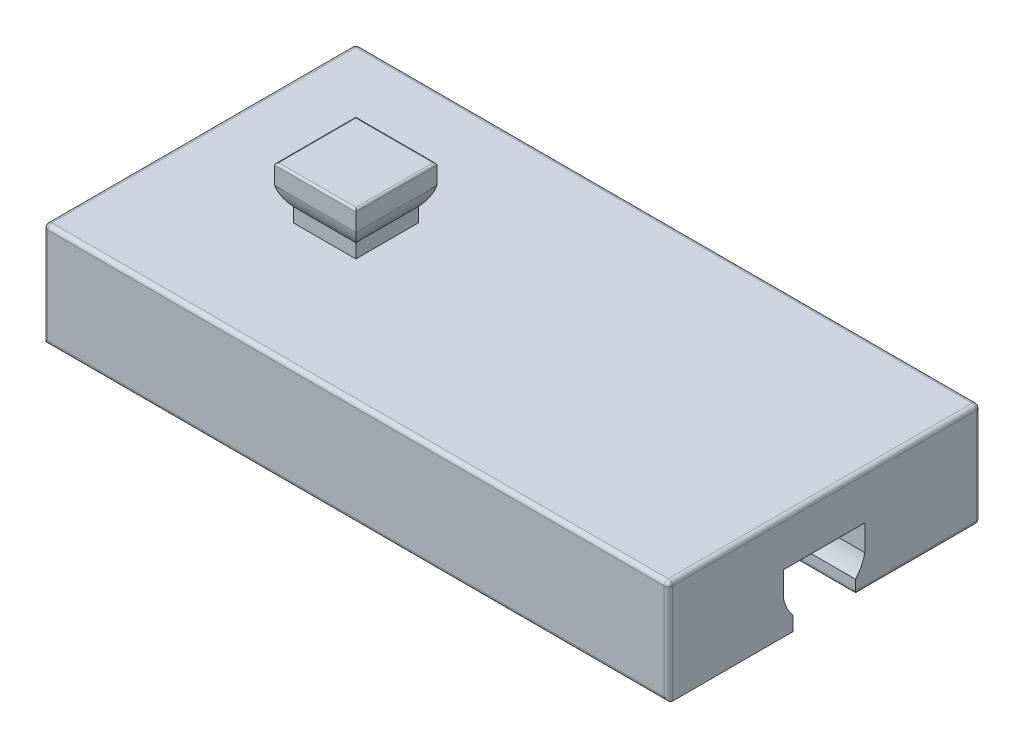
from build123d import *

# Parameters (mm, degrees)
SKETCH_1_W           = 30
SKETCH_1_H           = 15
EXTRUDE_1_DEPTH      = 5
CUT_EXTRUDE_1_REACH  = 33.325
FILLET_1_R           = 0.2
SKETCH_3_W           = 3
SKETCH_3_H           = 3
EXTRUDE_2_DEPTH      = 1
EXTRUDE_3_DEPTH      = 2
EXTRUDE_3_DEPTH_BACK = 2
CUT_EXTRUDE_2_REACH  = 28.652
FILLET_2_R           = 0.1


with BuildPart() as part:
    # 草图1 → 凸台-拉伸1 (new body)
    with BuildSketch(Plane(origin=(0, 0, 0), x_dir=(1, 0, 0), z_dir=(0, 1, 0))):
        Rectangle(SKETCH_1_W, SKETCH_1_H)
    extrude(amount=EXTRUDE_1_DEPTH)

    # 草图2 → 切除-拉伸1 (cut, up to next)
    with BuildSketch(Plane.ZY.offset(15), mode=Mode.PRIVATE) as cut_extrude_1_sk1:
        with BuildLine():
            Line((-1.5, 0), (-1.5, 0.677124344))
            ThreePointArc((-1.5, 0.677124344), (-1.780042303, 1.088161527), (-1.95, 1.555590279))
            Line((-1.95, 1.555590279), (-1.95, 2.8))
            Line((-1.95, 2.8), (1.95, 2.8))
            Line((1.95, 2.8), (1.95, 1.555590279))
            ThreePointArc((1.95, 1.555590279), (1.780042303, 1.088161527), (1.5, 0.677124344))
            Line((1.5, 0.677124344), (1.5, 0))
            Line((1.5, 0), (-1.5, 0))
        make_face()
    cut_extrude_1_tool1 = extrude(cut_extrude_1_sk1.sketch, amount=-CUT_EXTRUDE_1_REACH, mode=Mode.PRIVATE) & part.part
    add(cut_extrude_1_tool1.solids().sort_by_distance((-15, 1.479302, 0))[0], mode=Mode.SUBTRACT)

    # 圆角1
    fillet_1_edges = [part.edges().sort_by_distance(p)[0] for p in [
        (15, 2.5, -7.5),
        (-15, 2.5, -7.5),
        (0, 0, -7.5),
        (-15, 0, -4.5),
        (0, 0, -1.5),
        (-15, 2.5, 7.5),
        (15, 2.5, 7.5),
        (0, 0, 7.5),
        (0, 5, -7.5),
        (15, 5, 0),
        (0, 5, 7.5),
        (-15, 5, 0),
        (15, 0, -4.5),
    ]]
    fillet(fillet_1_edges, radius=FILLET_1_R)

    # 草图3 → 凸台-拉伸2 (add)
    with BuildSketch(Plane(origin=(0, 5, 0), x_dir=(-1, 0, 0), z_dir=(0, 1, 0))):
        with Locations((7.5, 0)):
            Rectangle(SKETCH_3_W, SKETCH_3_H)
    extrude(amount=EXTRUDE_2_DEPTH)

    # 草图4 → 凸台-拉伸3 (add, two sides: drawn at the far end of the back side and taken through both)
    with BuildSketch(Plane.XY.offset(-EXTRUDE_3_DEPTH_BACK)):
        with BuildLine():
            Line((-9.45, 7.5), (-5.55, 7.5))
            Line((-5.55, 7.5), (-5.55, 6.555590279))
            ThreePointArc((-5.55, 6.555590279), (-5.719957697, 6.088161527), (-6, 5.677124344))
            Line((-6, 5.677124344), (-9, 5.677124344))
            ThreePointArc((-9, 5.677124344), (-9.280042303, 6.088161527), (-9.45, 6.555590279))
            Line((-9.45, 6.555590279), (-9.45, 7.5))
        make_face()
    extrude(amount=EXTRUDE_3_DEPTH + EXTRUDE_3_DEPTH_BACK)

    # 草图5 → 切除-拉伸2 (cut, up to next)
    with BuildSketch(Plane.ZY.offset(9.45), mode=Mode.PRIVATE) as cut_extrude_2_sk1:
        with BuildLine():
            Line((-1.95, 7.5), (-1.95, 6.555590279))
            ThreePointArc((-1.95, 6.555590279), (-1.780042303, 6.088161527), (-1.5, 5.677124344))
            Line((-1.5, 5.677124344), (-2, 5.677124344))
            Line((-2, 5.677124344), (-2, 7.5))
            Line((-2, 7.5), (-1.95, 7.5))
        make_face()
    cut_extrude_2_tool1 = extrude(cut_extrude_2_sk1.sketch, amount=-CUT_EXTRUDE_2_REACH, mode=Mode.PRIVATE) & part.part
    # 草图5 → 切除-拉伸2 (cut, up to next)
    with BuildSketch(Plane.ZY.offset(9.45), mode=Mode.PRIVATE) as cut_extrude_2_sk2:
        with BuildLine():
            Line((2, 5.677124344), (2, 7.5))
            Line((2, 7.5), (1.95, 7.5))
            Line((1.95, 7.5), (1.95, 6.555590279))
            ThreePointArc((1.95, 6.555590279), (1.780042303, 6.088161527), (1.5, 5.677124344))
            Line((1.5, 5.677124344), (2, 5.677124344))
        make_face()
    cut_extrude_2_tool2 = extrude(cut_extrude_2_sk2.sketch, amount=-CUT_EXTRUDE_2_REACH, mode=Mode.PRIVATE) & part.part
    add(cut_extrude_2_tool1.solids().sort_by_distance((-9.45, 6.175075, -1.873038))[0], mode=Mode.SUBTRACT)
    add(cut_extrude_2_tool2.solids().sort_by_distance((-9.45, 6.175075, 1.873038))[0], mode=Mode.SUBTRACT)

    # 圆角2
    fillet_2_edges = [part.edges().sort_by_distance(p)[0] for p in [
        (-5.55, 7.5, 0),
        (-9.45, 7.5, 0),
        (-7.5, 7.5, -1.95),
        (-7.5, 7.5, 1.95),
    ]]
    fillet(fillet_2_edges, radius=FILLET_2_R)


solid = part.part
